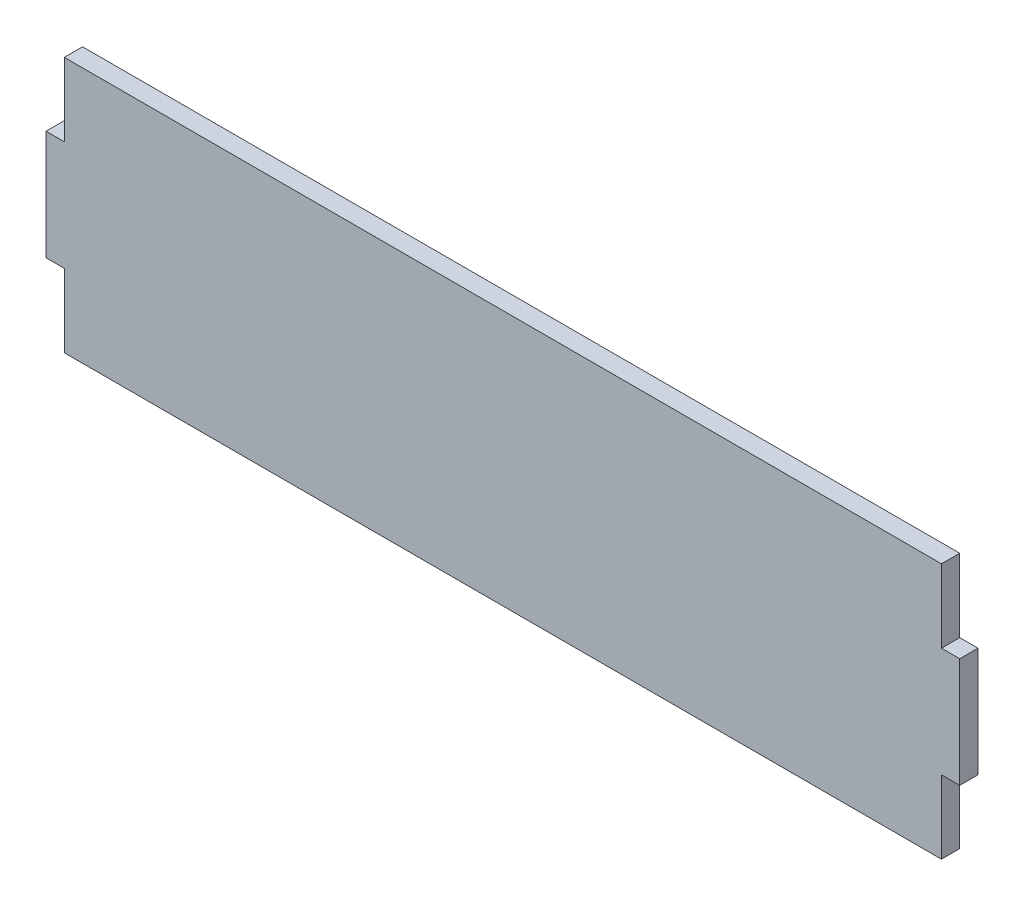
from build123d import *

# Parameters (mm, degrees)
BOSS_EXTRU_1_DEPTH = 5


with BuildPart() as part:
    # Esquisse1 → Boss.-Extru.1 (new body)
    with BuildSketch(Plane.XY):
        Polygon((0, 0), (240, 0), (240, 20), (245, 20), (245, 50), (240, 50), (240, 70), (0, 70), (0, 50), (-5, 50), (-5, 20), (0, 20), align=None)
    extrude(amount=BOSS_EXTRU_1_DEPTH)


solid = part.part
